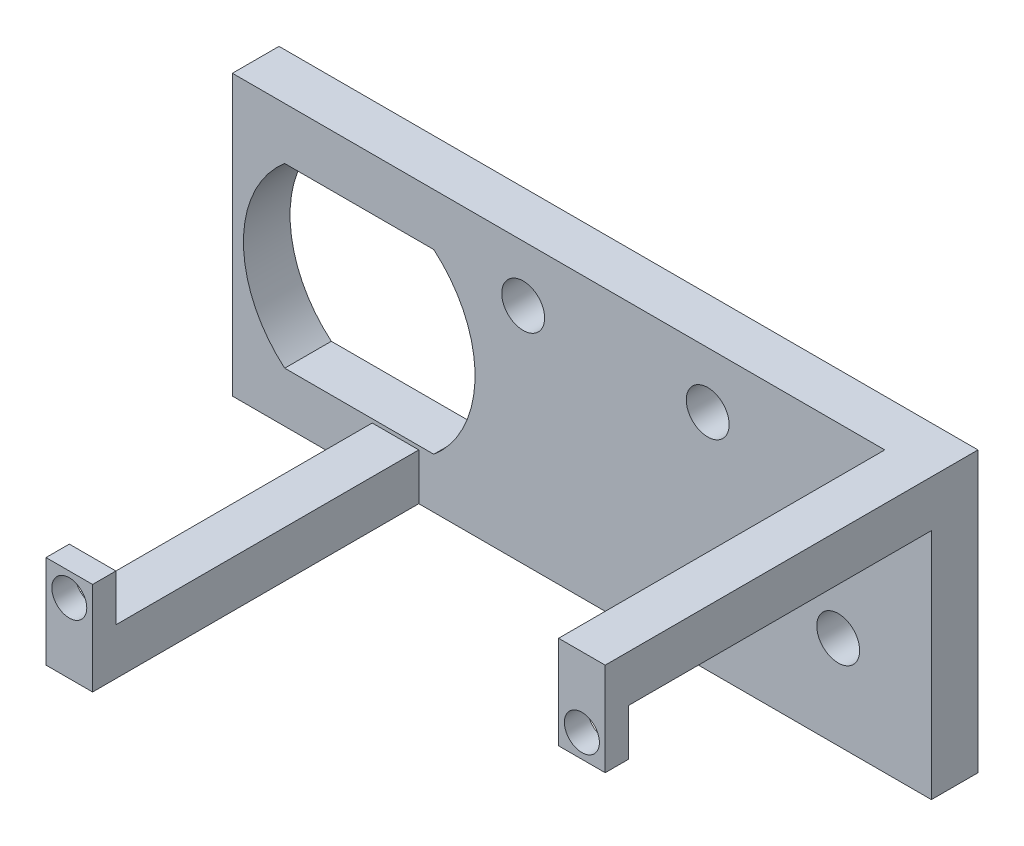
from build123d import *

# Parameters (mm, degrees)
SKETCH1_W           = 60
SKETCH1_H           = 30
SKETCH1_R           = 2.3
BOSS_EXTRUDE1_DEPTH = 5
SKETCH3_W           = 5
SKETCH3_H           = 5
BOSS_EXTRUDE2_DEPTH = 35
SKETCH5_W           = 5
SKETCH5_H           = 5
SKETCH5_R           = 1.875
BOSS_EXTRUDE3_DEPTH = 2.5
SKETCH6_W           = 5
SKETCH6_H           = 30
BOSS_EXTRUDE4_DEPTH = 15
CUT_EXTRUDE1_REACH  = 64.048


with BuildPart() as part:
    # Sketch1 → Boss-Extrude1 (new body)
    with BuildSketch(Plane.XY):
        Rectangle(SKETCH1_W, SKETCH1_H)
        with Locations((-13.800714267, 9.000714267)):
            Circle(SKETCH1_R, mode=Mode.SUBTRACT)
        with Locations((5.999285733, 9.000714267)):
            Circle(SKETCH1_R, mode=Mode.SUBTRACT)
        with Locations((20, -5)):
            Circle(SKETCH1_R, mode=Mode.SUBTRACT)
    extrude(amount=BOSS_EXTRUDE1_DEPTH)

    # Sketch3 → Boss-Extrude2 (add)
    with BuildSketch(Plane.XY.offset(5)):
        with Locations((27.5, 12.5)):
            Rectangle(SKETCH3_W, SKETCH3_H)
        with Locations((-27.5, -12.5)):
            Rectangle(SKETCH3_W, SKETCH3_H)
    extrude(amount=BOSS_EXTRUDE2_DEPTH)

    # Sketch5 → Boss-Extrude3 (add)
    # profile 1 of 2: a face of its own
    with BuildSketch(Plane.XY.offset(40)):
        with Locations((-27.5, -7.5)):
            Rectangle(SKETCH5_W, SKETCH5_H)
        with Locations((-27.5, -7.5)):
            Circle(SKETCH5_R, mode=Mode.SUBTRACT)
    # profile 2 of 2: a face of its own
    with BuildSketch(Plane.XY.offset(40)):
        with Locations((27.5, 7.5)):
            Rectangle(SKETCH5_W, SKETCH5_H)
        with Locations((27.5, 7.5)):
            Circle(SKETCH5_R, mode=Mode.SUBTRACT)
    extrude(amount=-BOSS_EXTRUDE3_DEPTH)

    # Sketch6 → Boss-Extrude4 (add)
    with BuildSketch(Plane.ZY.offset(30)):
        with Locations((2.5, 0)):
            Rectangle(SKETCH6_W, SKETCH6_H)
    extrude(amount=BOSS_EXTRUDE4_DEPTH)

    # Sketch7 → Cut-Extrude1 (cut, up to next)
    with BuildSketch(Plane(origin=(0, 0, 0), x_dir=(-1, 0, 0), z_dir=(0, 0, -1)), mode=Mode.PRIVATE) as cut_extrude1_sk1:
        with BuildLine():
            Line((23.394171206, 9.42), (39.386735103, 9.42))
            ThreePointArc((39.386735103, 9.42), (43.815453154, -0.09), (39.386735103, -9.6))
            Line((39.386735103, -9.6), (23.394171206, -9.6))
            ThreePointArc((23.394171206, -9.6), (18.965453154, -0.09), (23.394171206, 9.42))
        make_face()
    cut_extrude1_tool1 = extrude(cut_extrude1_sk1.sketch, amount=-CUT_EXTRUDE1_REACH, mode=Mode.PRIVATE) & part.part
    add(cut_extrude1_tool1.solids().sort_by_distance((-31.390453, -0.09, 0))[0], mode=Mode.SUBTRACT)


solid = part.part
